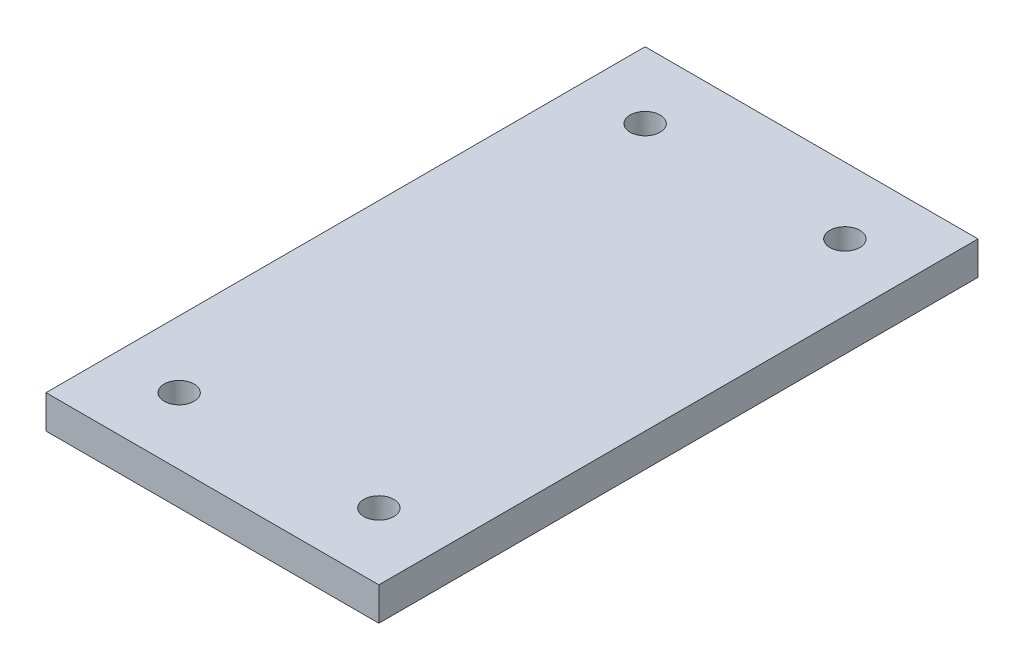
from build123d import *

# Parameters (mm, degrees)
SKETCH1_W           = 50
SKETCH1_H           = 90
SKETCH1_R           = 2.25
BOSS_EXTRUDE1_DEPTH = 2.5


with BuildPart() as part:
    # Sketch1 → Boss-Extrude1 (new, symmetric)
    with BuildSketch(Plane(origin=(0, 0, 0), x_dir=(1, 0, 0), z_dir=(0, 1, 0))):
        Rectangle(SKETCH1_W, SKETCH1_H)
        with Locations(Location((15, 35, 0), (0, 0, 270))):
            Circle(SKETCH1_R, mode=Mode.SUBTRACT)
        with Locations(Location((15, -35, 0), (0, 0, 90))):
            Circle(SKETCH1_R, mode=Mode.SUBTRACT)
        with Locations(Location((-15, -35, 0), (0, 0, 270))):
            Circle(SKETCH1_R, mode=Mode.SUBTRACT)
        with Locations(Location((-15, 35, 0), (0, 0, 90))):
            Circle(SKETCH1_R, mode=Mode.SUBTRACT)
    extrude(amount=BOSS_EXTRUDE1_DEPTH, both=True)


solid = part.part
